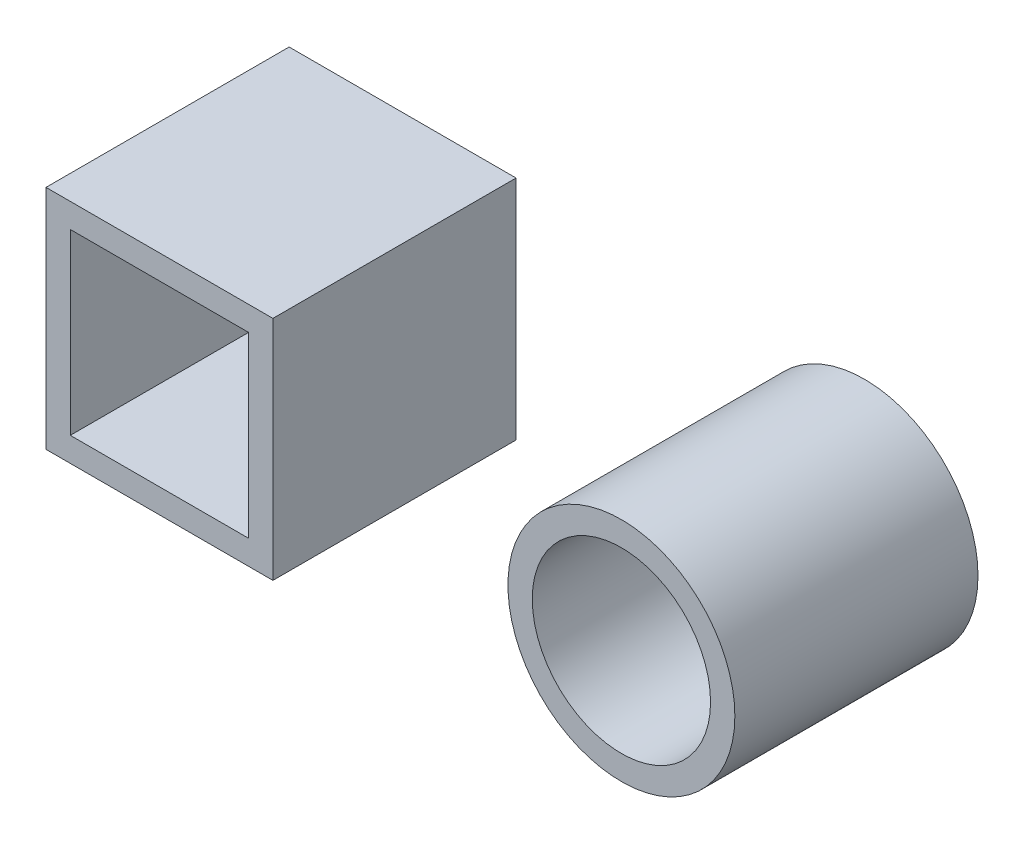
from build123d import *

# Parameters (mm, degrees)
SKETCH3_W             = 70
SKETCH3_H             = 70
SKETCH3_W_2           = 55
SKETCH3_H_2           = 55
BOSS_EXTRUDE4_DEPTH   = 75
SKETCH3_R             = 35
SKETCH3_R_2           = 27.5
BOSS_EXTRUDE4_2_DEPTH = 75


with BuildPart() as part:
    # Sketch3 → Boss-Extrude4 (new body)
    with BuildSketch(Plane.XY):
        with Locations((-70, 0)):
            Rectangle(SKETCH3_W, SKETCH3_H)
        with Locations((-70, 0)):
            Rectangle(SKETCH3_W_2, SKETCH3_H_2, mode=Mode.SUBTRACT)
    extrude(amount=-BOSS_EXTRUDE4_DEPTH)


with BuildPart() as body_2:
    # Sketch3 → Boss-Extrude4 2 (new body)
    with BuildSketch(Plane.XY):
        with Locations((72.5, 0)):
            Circle(SKETCH3_R)
        with Locations((72.5, 0)):
            Circle(SKETCH3_R_2, mode=Mode.SUBTRACT)
    extrude(amount=-BOSS_EXTRUDE4_2_DEPTH)


solid = Compound([part.part, body_2.part])
